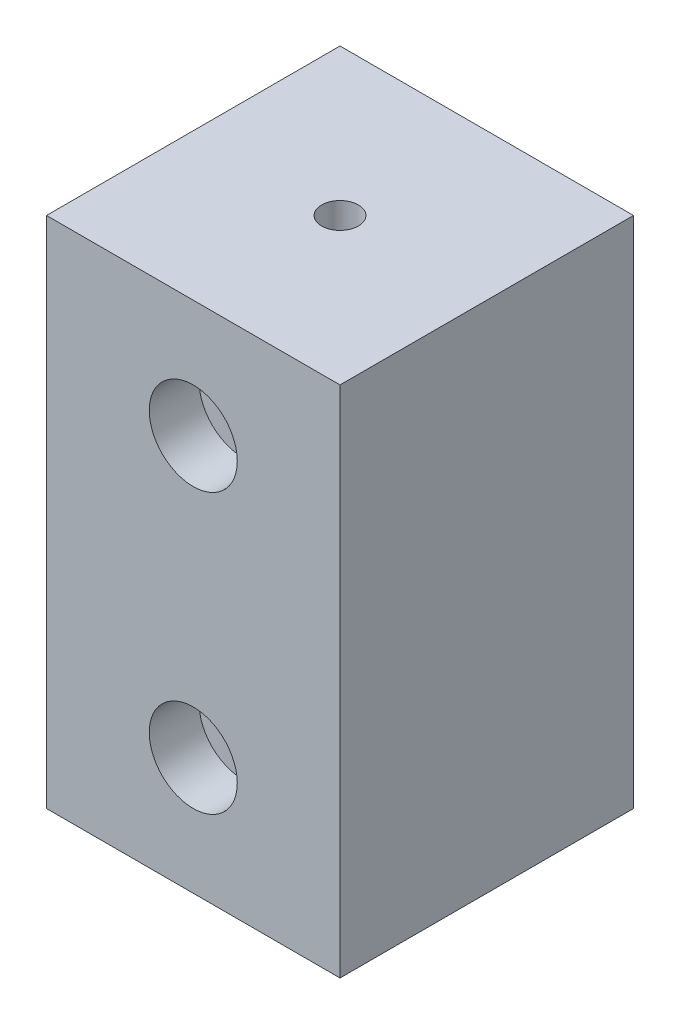
from build123d import *

# Parameters (mm, degrees)
SKETCH1_W                                            = 20
SKETCH1_H                                            = 35
BOSS_EXTRUDE1_DEPTH                                  = 20
CBORE_FOR_M3_HEXAGON_SOCKET_HEAD_CAP_SCR_D           = 3.2
CBORE_FOR_M3_HEXAGON_SOCKET_HEAD_CAP_SCR_CBORE_D     = 6
CBORE_FOR_M3_HEXAGON_SOCKET_HEAD_CAP_SCR_CBORE_DEPTH = 3.4
TAP_DRILL_FOR_M3_TAP1_D                              = 2.5
TAP_DRILL_FOR_M3_TAP1_DEPTH                          = 5
TAP_DRILL_FOR_M3_TAP1_TIP                            = 0.751075774


with BuildPart() as part:
    # Sketch1 → Boss-Extrude1 (new body)
    with BuildSketch(Plane.XY):
        Rectangle(SKETCH1_W, SKETCH1_H)
    extrude(amount=BOSS_EXTRUDE1_DEPTH)

    # CBORE for M3 Hexagon socket head cap screws1 (through all)
    with Locations(Plane(origin=(0, 9.5, 20), x_dir=(1, 0, 0), z_dir=(0, 0, 1))):
        with Locations((0, 0), (0, -19)):
            CounterBoreHole(CBORE_FOR_M3_HEXAGON_SOCKET_HEAD_CAP_SCR_D / 2, CBORE_FOR_M3_HEXAGON_SOCKET_HEAD_CAP_SCR_CBORE_D / 2, CBORE_FOR_M3_HEXAGON_SOCKET_HEAD_CAP_SCR_CBORE_DEPTH)

    # Tap Drill for M3 Tap1
    with Locations(Plane(origin=(0, 17.5, 0), x_dir=(1, 0, 0), z_dir=(0, 1, 0))):
        with Locations((0, -10)):
            Hole(TAP_DRILL_FOR_M3_TAP1_D / 2, depth=TAP_DRILL_FOR_M3_TAP1_DEPTH)
            with Locations((0, 0, -(TAP_DRILL_FOR_M3_TAP1_DEPTH + TAP_DRILL_FOR_M3_TAP1_TIP / 2))):  # 118° drill point
                Cone(0, TAP_DRILL_FOR_M3_TAP1_D / 2, TAP_DRILL_FOR_M3_TAP1_TIP, mode=Mode.SUBTRACT)


solid = part.part
